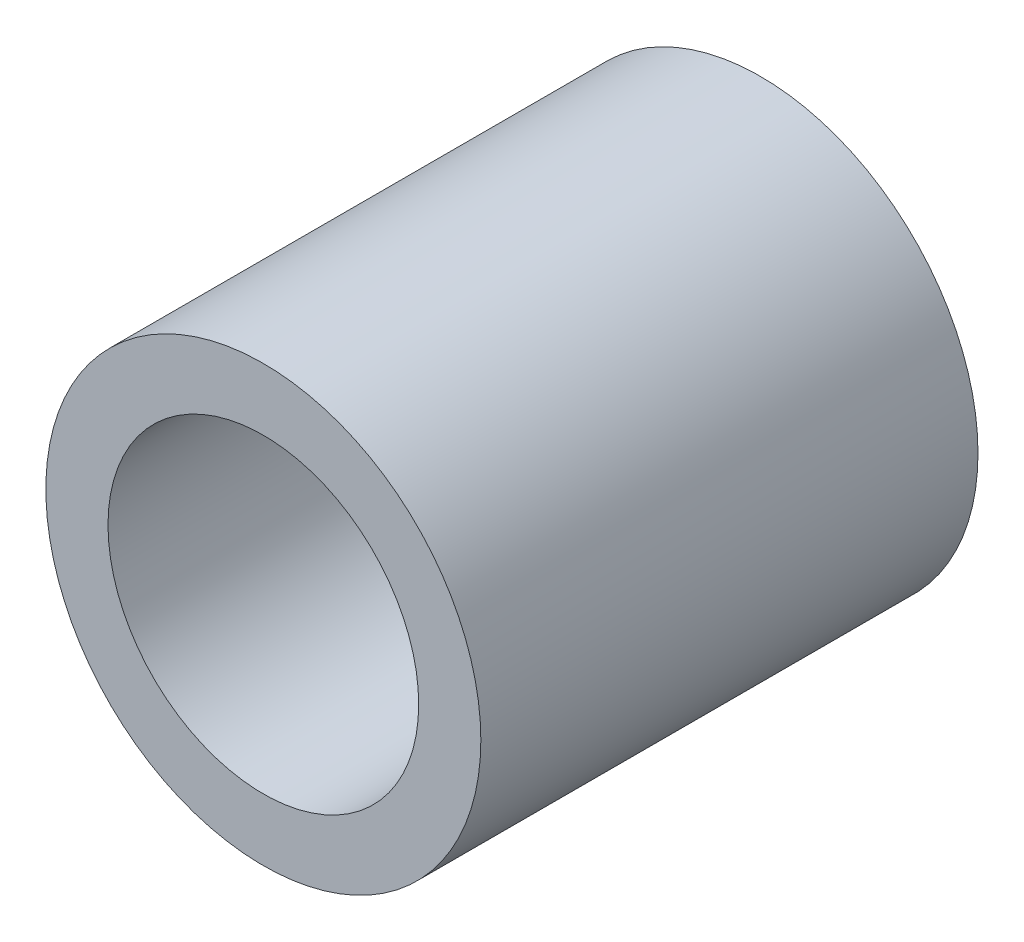
from build123d import *

# Parameters (mm, degrees)
SKETCH1_R           = 11.1125
SKETCH1_R_2         = 7.9375
BOSS_EXTRUDE1_DEPTH = 25.4


with BuildPart() as part:
    # Sketch1 → Boss-Extrude1 (new body)
    with BuildSketch(Plane(origin=(0, 0, 0), x_dir=(0, 1, 0), z_dir=(0, 0, 1))):
        with Locations(Location((0, 0, 0), (0, 0, 270))):
            Circle(SKETCH1_R)
        with Locations(Location((0, 0, 0), (0, 0, 270))):
            Circle(SKETCH1_R_2, mode=Mode.SUBTRACT)
    extrude(amount=BOSS_EXTRUDE1_DEPTH)


solid = part.part
